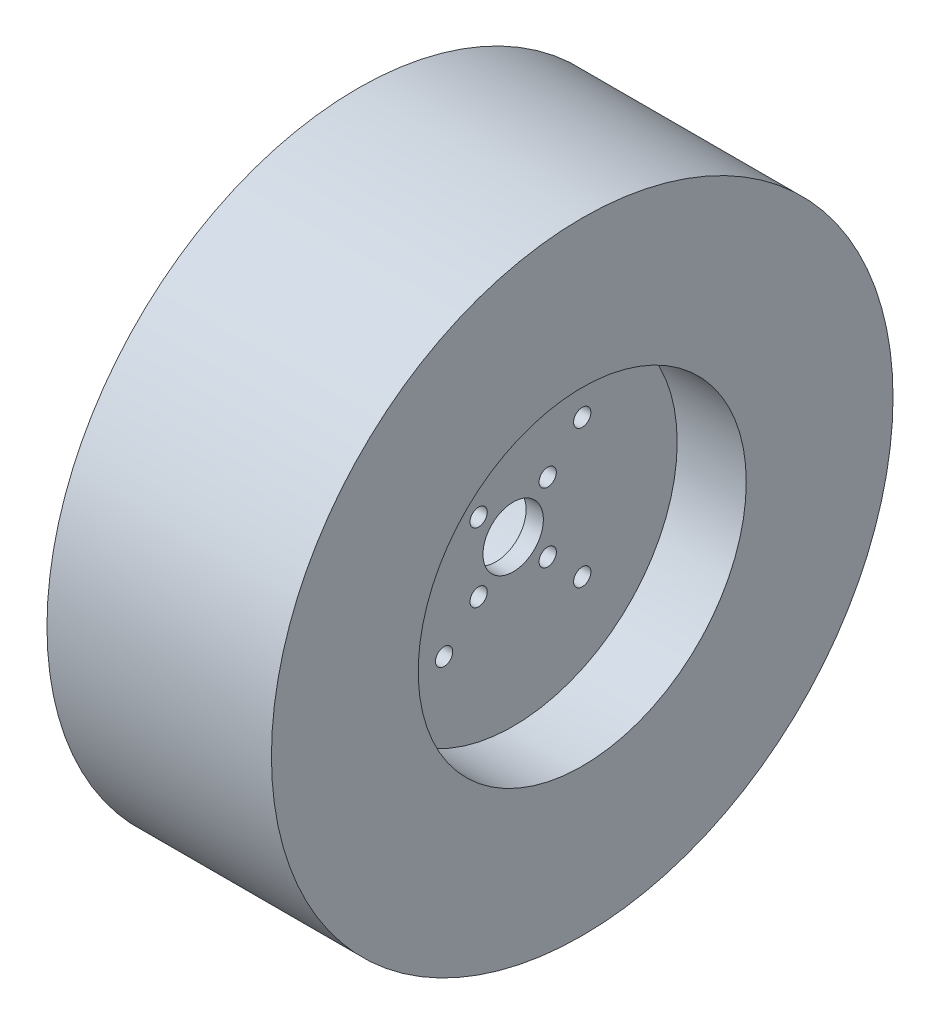
from build123d import *

# Parameters (mm, degrees)
SK_TYRE_R               = 72
EX_TYRE_DEPTH           = 52
SK_RECESSDEEP_R         = 38
CUT_RECESSDEEP_DEPTH    = 32
CUT_RECESSSHALLOW_START = -16
SK_RECESSSHALLOW_R      = 38
CUT_RECESSSHALLOW_DEPTH = 16
SK_WEBHOLES_R           = 7
SK_WEBHOLES_R_2         = 2
CUT_WEBHOLES_DEPTH      = 4


with BuildPart() as part:
    # SK_Tyre → EX_Tyre (new body)
    with BuildSketch(Plane(origin=(-32, 0, 0), x_dir=(0, 0, -1), z_dir=(1, 0, 0))):
        Circle(SK_TYRE_R)
    extrude(amount=EX_TYRE_DEPTH)

    # SK_RecessDeep → CUT_RecessDeep (cut)
    with BuildSketch(Plane(origin=(-32, 0, 0), x_dir=(0, 0, -1), z_dir=(1, 0, 0))):
        Circle(SK_RECESSDEEP_R)
    extrude(amount=CUT_RECESSDEEP_DEPTH, mode=Mode.SUBTRACT)

    # SK_RecessShallow → CUT_RecessShallow (cut)
    with BuildSketch(Plane(origin=(20, 0, 0), x_dir=(0, 0, -1), z_dir=(1, 0, 0)).offset(CUT_RECESSSHALLOW_START)):
        Circle(SK_RECESSSHALLOW_R)
    extrude(amount=CUT_RECESSSHALLOW_DEPTH, mode=Mode.SUBTRACT)

    # SK_WebHoles → CUT_WebHoles (cut)
    with BuildSketch(Plane(origin=(0, 0, 0), x_dir=(0, 0, -1), z_dir=(1, 0, 0))):
        Circle(SK_WEBHOLES_R)
        with Locations((-8, 8)):
            Circle(SK_WEBHOLES_R_2)
        with Locations((-8, -8)):
            Circle(SK_WEBHOLES_R_2)
        with Locations((8, 8)):
            Circle(SK_WEBHOLES_R_2)
        with Locations((8, -8)):
            Circle(SK_WEBHOLES_R_2)
        with Locations((-16, 16)):
            Circle(SK_WEBHOLES_R_2)
        with Locations((-16, -16)):
            Circle(SK_WEBHOLES_R_2)
        with Locations((16, 16)):
            Circle(SK_WEBHOLES_R_2)
        with Locations((16, -16)):
            Circle(SK_WEBHOLES_R_2)
    extrude(amount=CUT_WEBHOLES_DEPTH, mode=Mode.SUBTRACT)


solid = part.part
